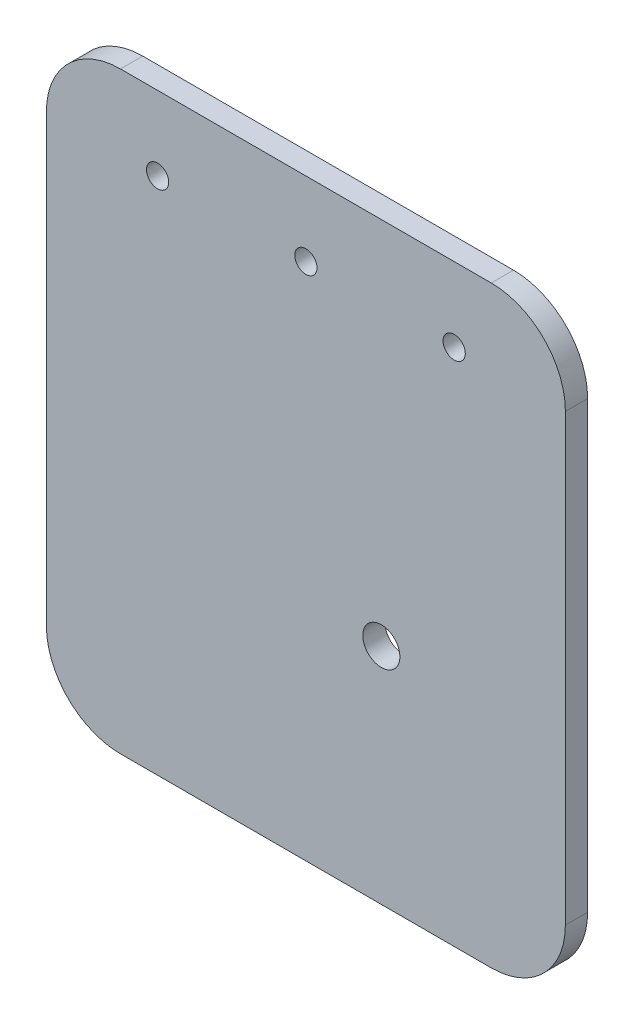
from build123d import *

# Parameters (mm, degrees)
SKETCH_1_W          = 70
SKETCH_1_H          = 80
EXTRUDE_1_DEPTH     = 3
SKETCH_2_R          = 2.5
CUT_EXTRUDE_1_DEPTH = 10
SKETCH_3_R          = 1.5
CUT_EXTRUDE_2_DEPTH = 10
FILLET_1_R          = 10


with BuildPart() as part:
    # 草图1 → 凸台-拉伸1 (new body)
    with BuildSketch(Plane.XY):
        Rectangle(SKETCH_1_W, SKETCH_1_H)
    extrude(amount=EXTRUDE_1_DEPTH)

    # 草图2 → 切除-拉伸1 (cut)
    with BuildSketch(Plane(origin=(0, 0, 0), x_dir=(-1, 0, 0), z_dir=(0, 0, -1))):
        with Locations((-10.175, -9.825)):
            Circle(SKETCH_2_R)
    extrude(amount=-CUT_EXTRUDE_1_DEPTH, mode=Mode.SUBTRACT)

    # 草图3 → 切除-拉伸2 (cut)
    with BuildSketch(Plane.XY.offset(3)):
        with Locations((0, 30)):
            Circle(SKETCH_3_R)
        with Locations((20, 30)):
            Circle(SKETCH_3_R)
        with Locations((-20, 30)):
            Circle(SKETCH_3_R)
    extrude(amount=-CUT_EXTRUDE_2_DEPTH, mode=Mode.SUBTRACT)

    # 圆角1
    fillet_1_edges = [part.edges().sort_by_distance(p)[0] for p in [
        (35, -40, 1.5),
        (-35, -40, 1.5),
        (-35, 40, 1.5),
        (35, 40, 1.5),
    ]]
    fillet(fillet_1_edges, radius=FILLET_1_R)


solid = part.part
